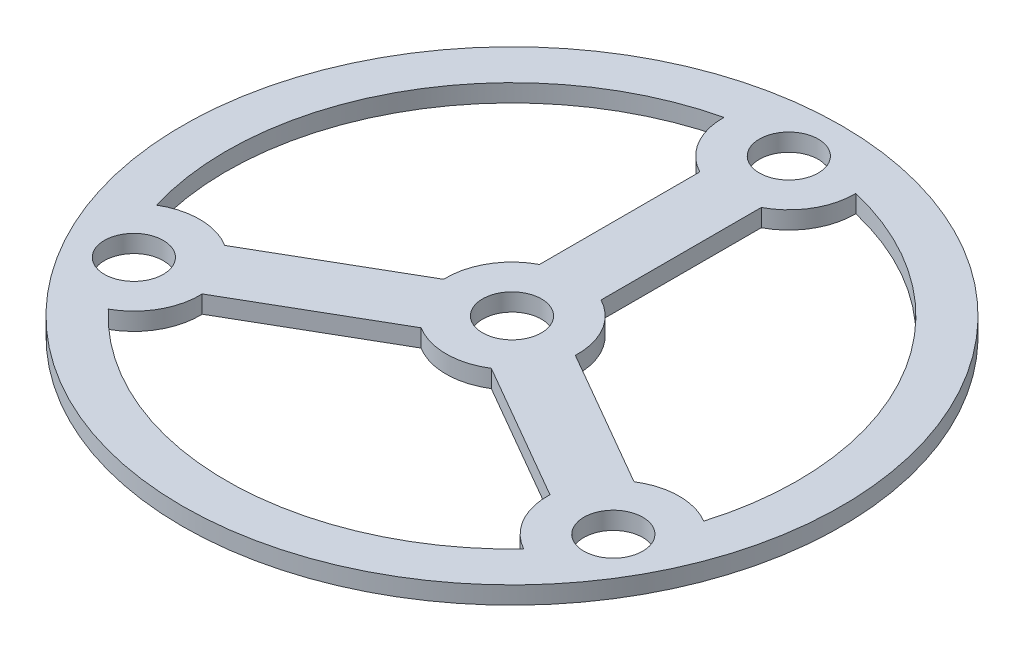
from build123d import *
from build123d.topology import SkipClean

# Parameters (mm, degrees)
SKETCH1_R           = 37.5
SKETCH1_R_2         = 3.35
BOSS_EXTRUDE1_DEPTH = 2
BOSS_EXTRUDE2_DEPTH = 2


with BuildPart() as part:
    # Sketch1 → Boss-Extrude1 (new body)
    with BuildSketch(Plane(origin=(0, 0, 0), x_dir=(1, 0, 0), z_dir=(0, 1, 0))):
        with Locations(Location((0, 0, 0), (0, 0, 270))):
            Circle(SKETCH1_R)
        with Locations(Location((0, 31.5, 0), (0, 0, 270))):
            Circle(SKETCH1_R_2, mode=Mode.SUBTRACT)
        with Locations(Location((27.279800219, -15.75, 0), (0, 0, 270))):
            Circle(SKETCH1_R_2, mode=Mode.SUBTRACT)
        with Locations(Location((-27.279800219, -15.75, 0), (0, 0, 270))):
            Circle(SKETCH1_R_2, mode=Mode.SUBTRACT)
        with BuildLine():
            ThreePointArc((-7.498991072, 31.623015873), (-28.145825623, 16.25), (-31.135830626, -9.317191166))
            ThreePointArc((-31.135830626, -9.317191166), (-20.784609691, -12), (-23.636839554, -22.305824707))
            ThreePointArc((-23.636839554, -22.305824707), (0, -32.5), (23.636839554, -22.305824707))
            ThreePointArc((23.636839554, -22.305824707), (20.784609691, -12), (31.135830626, -9.317191166))
            ThreePointArc((31.135830626, -9.317191166), (28.145825623, 16.25), (7.498991072, 31.623015873))
            ThreePointArc((7.498991072, 31.623015873), (0, 24), (-7.498991072, 31.623015873))
        make_face(mode=Mode.SUBTRACT)
    extrude(amount=BOSS_EXTRUDE1_DEPTH)

    # Sketch2 → Boss-Extrude2 (add)
    with SkipClean():  # the faces are left unmerged after this step: merging them gives an invalid solid
        with BuildSketch(Plane(origin=(0, 0, 0), x_dir=(1, 0, 0), z_dir=(0, 1, 0))):
            with BuildLine():
                Line((-3.5, 31.5), (-3.5, 6.633249581))
                ThreePointArc((-3.5, 6.633249581), (-6.495190528, 3.75), (-7.494562647, -0.285535877))
                Line((-7.494562647, -0.285535877), (-29.029800219, -12.718911087))
                Line((-29.029800219, -12.718911087), (-28.954800219, -12.848814897))
                ThreePointArc((-28.954800219, -12.848814897), (-24.378615117, -14.075), (-25.604800219, -18.651185103))
                Line((-25.604800219, -18.651185103), (-25.529800219, -18.781088913))
                Line((-25.529800219, -18.781088913), (-3.994562647, -6.347713704))
                ThreePointArc((-3.994562647, -6.347713704), (0, -7.5), (3.994562647, -6.347713704))
                Line((3.994562647, -6.347713704), (25.529800219, -18.781088913))
                Line((25.529800219, -18.781088913), (25.604800219, -18.651185103))
                ThreePointArc((25.604800219, -18.651185103), (24.378615117, -14.075), (28.954800219, -12.848814897))
                Line((28.954800219, -12.848814897), (29.029800219, -12.718911087))
                Line((29.029800219, -12.718911087), (7.494562647, -0.285535877))
                ThreePointArc((7.494562647, -0.285535877), (6.495190528, 3.75), (3.5, 6.633249581))
                Line((3.5, 6.633249581), (3.5, 31.5))
                Line((3.5, 31.5), (3.35, 31.5))
                ThreePointArc((3.35, 31.5), (0, 28.15), (-3.35, 31.5))
                Line((-3.35, 31.5), (-3.5, 31.5))
            make_face()
            with BuildLine():
                ThreePointArc((-1.675, 2.901185103), (2.901185103, 1.675), (1.675, -2.901185103))
                ThreePointArc((1.675, -2.901185103), (-2.901185103, -1.675), (-1.675, 2.901185103))
            make_face(mode=Mode.SUBTRACT)
        extrude(amount=BOSS_EXTRUDE2_DEPTH)


solid = part.part
